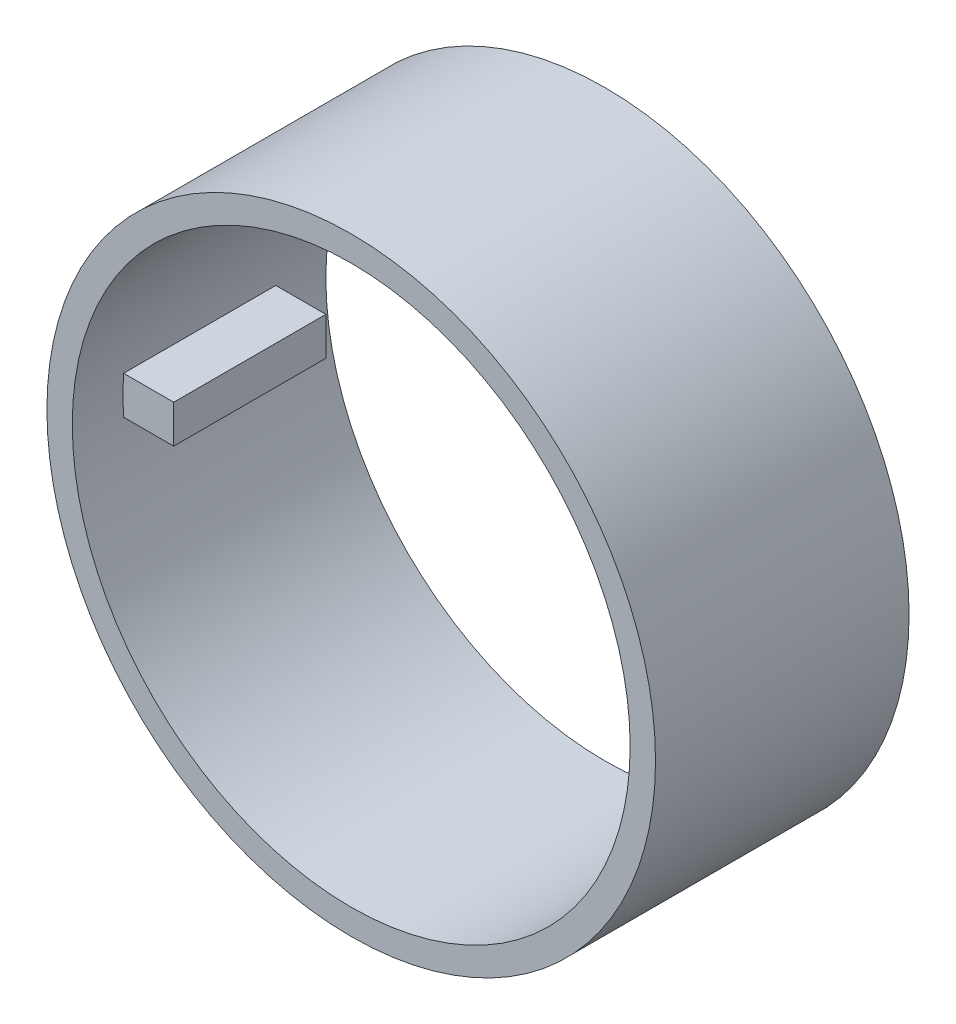
from build123d import *

# Parameters (mm, degrees)
SKETCH1_R           = 152.4
SKETCH1_R_2         = 139.7
BOSS_EXTRUDE1_DEPTH = 63.5
SKETCH2_W           = 34.925
SKETCH2_H           = 19.05
BOSS_EXTRUDE2_DEPTH = 38.1


with BuildPart() as part:
    # Sketch1 → Boss-Extrude1 (new, symmetric)
    with BuildSketch(Plane.XY):
        Circle(SKETCH1_R)
        Circle(SKETCH1_R_2, mode=Mode.SUBTRACT)
    extrude(amount=BOSS_EXTRUDE1_DEPTH, both=True)

    # Sketch2 → Boss-Extrude2 (add, symmetric)
    with BuildSketch(Plane.XY):
        with Locations((-131.7625, 0)):
            Rectangle(SKETCH2_W, SKETCH2_H)
    boss_extrude2 = extrude(amount=BOSS_EXTRUDE2_DEPTH, both=True)

    # Mirror2: Boss-Extrude2 across plane
    add(boss_extrude2.mirror(Plane(origin=(0, 0, 0), x_dir=(0, 0, 1), z_dir=(1, 0, 0))))


solid = part.part
